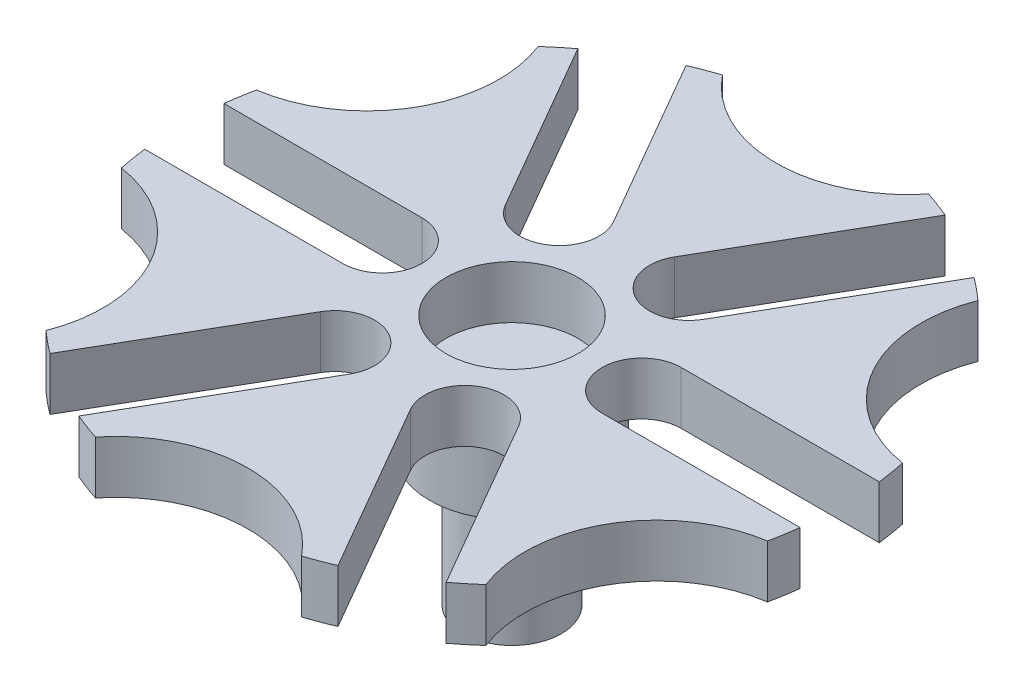
from build123d import *

# Parameters (mm, degrees)
SKETCH1_R           = 10
BOSS_EXTRUDE1_DEPTH = 8
SKETCH2_R           = 12.5
BOSS_EXTRUDE2_DEPTH = 10
SKETCH3_R           = 7.5
BOSS_EXTRUDE3_DEPTH = 20


with BuildPart() as part:
    # Sketch1 → Boss-Extrude1 (new body)
    with BuildSketch(Plane(origin=(0, 0, 0), x_dir=(1, 0, 0), z_dir=(0, 1, 0))):
        with BuildLine():
            Line((-19.64, -6), (-49.638694584, -6))
            ThreePointArc((-49.638694584, -6), (-49.335912066, -8.122055195), (-48.942454178, -10.229182717))
            ThreePointArc((-48.942454178, -10.229182717), (-34.641016151, -20), (-33.329959182, -37.270817283))
            ThreePointArc((-33.329959182, -37.270817283), (-31.701862163, -38.665125571), (-30.015499715, -39.98837052))
            Line((-30.015499715, -39.98837052), (-15.016152423, -14.00873893))
            ThreePointArc((-15.016152423, -14.00873893), (-6.82, -11.812586508), (-4.623847577, -20.00873893))
            Line((-4.623847577, -20.00873893), (-19.623194869, -45.98837052))
            ThreePointArc((-19.623194869, -45.98837052), (-17.634049903, -46.787180766), (-15.612494996, -47.5))
            ThreePointArc((-15.612494996, -47.5), (0, -40), (15.612494996, -47.5))
            ThreePointArc((15.612494996, -47.5), (17.634049903, -46.787180766), (19.623194869, -45.98837052))
            Line((19.623194869, -45.98837052), (4.623847577, -20.00873893))
            ThreePointArc((4.623847577, -20.00873893), (6.82, -11.812586508), (15.016152423, -14.00873893))
            Line((15.016152423, -14.00873893), (30.015499715, -39.98837052))
            ThreePointArc((30.015499715, -39.98837052), (31.701862163, -38.665125571), (33.329959182, -37.270817283))
            ThreePointArc((33.329959182, -37.270817283), (34.641016151, -20), (48.942454178, -10.229182717))
            ThreePointArc((48.942454178, -10.229182717), (49.335912066, -8.122055195), (49.638694584, -6))
            Line((49.638694584, -6), (19.64, -6))
            ThreePointArc((19.64, -6), (13.64, 0), (19.64, 6))
            Line((19.64, 6), (49.638694584, 6))
            ThreePointArc((49.638694584, 6), (49.335912066, 8.122055195), (48.942454178, 10.229182717))
            ThreePointArc((48.942454178, 10.229182717), (34.641016151, 20), (33.329959182, 37.270817283))
            ThreePointArc((33.329959182, 37.270817283), (31.701862163, 38.665125571), (30.015499715, 39.98837052))
            Line((30.015499715, 39.98837052), (15.016152423, 14.00873893))
            ThreePointArc((15.016152423, 14.00873893), (6.82, 11.812586508), (4.623847577, 20.00873893))
            Line((4.623847577, 20.00873893), (19.623194869, 45.98837052))
            ThreePointArc((19.623194869, 45.98837052), (17.634049903, 46.787180766), (15.612494996, 47.5))
            ThreePointArc((15.612494996, 47.5), (0, 40), (-15.612494996, 47.5))
            ThreePointArc((-15.612494996, 47.5), (-17.634049903, 46.787180766), (-19.623194869, 45.98837052))
            Line((-19.623194869, 45.98837052), (-4.623847577, 20.00873893))
            ThreePointArc((-4.623847577, 20.00873893), (-6.82, 11.812586508), (-15.016152423, 14.00873893))
            Line((-15.016152423, 14.00873893), (-30.015499715, 39.98837052))
            ThreePointArc((-30.015499715, 39.98837052), (-31.701862163, 38.665125571), (-33.329959182, 37.270817283))
            ThreePointArc((-33.329959182, 37.270817283), (-34.641016151, 20), (-48.942454178, 10.229182717))
            ThreePointArc((-48.942454178, 10.229182717), (-49.335912066, 8.122055195), (-49.638694584, 6))
            Line((-49.638694584, 6), (-19.64, 6))
            ThreePointArc((-19.64, 6), (-13.64, 0), (-19.64, -6))
        make_face()
        with Locations(Location((0, 0, 0), (0, 0, 270))):
            Circle(SKETCH1_R, mode=Mode.SUBTRACT)
    extrude(amount=-BOSS_EXTRUDE1_DEPTH)

    # Sketch2 → Boss-Extrude2 (add)
    with BuildSketch(Plane.XZ.offset(8)):
        with Locations(Location((0, 0, 0), (0, 0, 90))):
            Circle(SKETCH2_R)
    extrude(amount=BOSS_EXTRUDE2_DEPTH)

    # Sketch3 → Boss-Extrude3 (add)
    with BuildSketch(Plane.XZ.offset(18)):
        with Locations(Location((0, 0, 0), (0, 0, 270))):
            Circle(SKETCH3_R)
    extrude(amount=BOSS_EXTRUDE3_DEPTH)


solid = part.part
